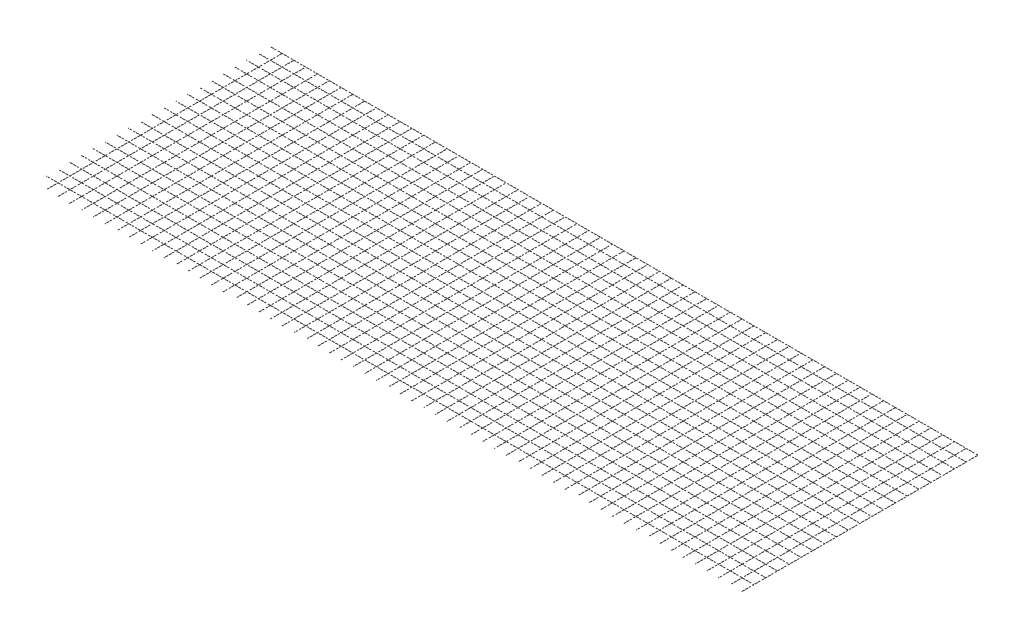
from build123d import *

# Parameters (mm, degrees)
SKETCH2_R              = 0.5
BOSS_EXTRUDE2_DEPTH    = 2000
BOSS_EXTRUDE2_2_DEPTH  = 2000
BOSS_EXTRUDE2_3_DEPTH  = 2000
BOSS_EXTRUDE2_4_DEPTH  = 2000
BOSS_EXTRUDE2_5_DEPTH  = 2000
BOSS_EXTRUDE2_6_DEPTH  = 2000
BOSS_EXTRUDE2_7_DEPTH  = 2000
BOSS_EXTRUDE2_8_DEPTH  = 2000
BOSS_EXTRUDE2_9_DEPTH  = 2000
BOSS_EXTRUDE2_10_DEPTH = 2000
BOSS_EXTRUDE2_11_DEPTH = 2000
BOSS_EXTRUDE2_12_DEPTH = 2000
BOSS_EXTRUDE2_13_DEPTH = 2000
BOSS_EXTRUDE2_14_DEPTH = 2000
BOSS_EXTRUDE2_15_DEPTH = 2000
BOSS_EXTRUDE2_16_DEPTH = 2000
BOSS_EXTRUDE2_17_DEPTH = 2000
BOSS_EXTRUDE2_18_DEPTH = 2000
BOSS_EXTRUDE2_19_DEPTH = 2000
BOSS_EXTRUDE2_20_DEPTH = 2000
BOSS_EXTRUDE2_21_DEPTH = 2000
BOSS_EXTRUDE2_22_DEPTH = 2000
BOSS_EXTRUDE2_23_DEPTH = 2000
BOSS_EXTRUDE2_24_DEPTH = 2000
BOSS_EXTRUDE2_25_DEPTH = 2000
BOSS_EXTRUDE2_26_DEPTH = 2000
BOSS_EXTRUDE2_27_DEPTH = 2000
BOSS_EXTRUDE2_28_DEPTH = 2000
BOSS_EXTRUDE2_29_DEPTH = 2000
BOSS_EXTRUDE2_30_DEPTH = 2000
BOSS_EXTRUDE2_31_DEPTH = 2000
BOSS_EXTRUDE2_32_DEPTH = 2000
BOSS_EXTRUDE2_33_DEPTH = 2000
BOSS_EXTRUDE2_34_DEPTH = 2000
BOSS_EXTRUDE2_35_DEPTH = 2000
BOSS_EXTRUDE2_36_DEPTH = 2000
BOSS_EXTRUDE2_37_DEPTH = 2000
BOSS_EXTRUDE2_38_DEPTH = 2000
BOSS_EXTRUDE2_39_DEPTH = 2000
BOSS_EXTRUDE2_40_DEPTH = 2000
BOSS_EXTRUDE2_41_DEPTH = 2000
BOSS_EXTRUDE2_42_DEPTH = 2000
BOSS_EXTRUDE2_43_DEPTH = 2000
BOSS_EXTRUDE2_44_DEPTH = 2000
BOSS_EXTRUDE2_45_DEPTH = 2000
BOSS_EXTRUDE2_46_DEPTH = 2000
BOSS_EXTRUDE2_47_DEPTH = 2000
BOSS_EXTRUDE2_48_DEPTH = 2000
BOSS_EXTRUDE2_49_DEPTH = 2000
BOSS_EXTRUDE2_50_DEPTH = 2000
BOSS_EXTRUDE2_51_DEPTH = 2000
BOSS_EXTRUDE2_52_DEPTH = 2000
BOSS_EXTRUDE2_53_DEPTH = 2000
BOSS_EXTRUDE2_54_DEPTH = 2000
BOSS_EXTRUDE2_55_DEPTH = 2000
BOSS_EXTRUDE2_56_DEPTH = 2000
BOSS_EXTRUDE2_57_DEPTH = 2000
BOSS_EXTRUDE2_58_DEPTH = 2000
BOSS_EXTRUDE2_59_DEPTH = 2000
BOSS_EXTRUDE2_60_DEPTH = 2000
SKETCH3_R              = 0.5
BOSS_EXTRUDE3_DEPTH    = 6000
BOSS_EXTRUDE3_2_DEPTH  = 6000
BOSS_EXTRUDE3_3_DEPTH  = 6000
BOSS_EXTRUDE3_4_DEPTH  = 6000
BOSS_EXTRUDE3_5_DEPTH  = 6000
BOSS_EXTRUDE3_6_DEPTH  = 6000
BOSS_EXTRUDE3_7_DEPTH  = 6000
BOSS_EXTRUDE3_8_DEPTH  = 6000
BOSS_EXTRUDE3_9_DEPTH  = 6000
BOSS_EXTRUDE3_10_DEPTH = 6000
BOSS_EXTRUDE3_11_DEPTH = 6000
BOSS_EXTRUDE3_12_DEPTH = 6000
BOSS_EXTRUDE3_13_DEPTH = 6000
BOSS_EXTRUDE3_14_DEPTH = 6000
BOSS_EXTRUDE3_15_DEPTH = 6000
BOSS_EXTRUDE3_16_DEPTH = 6000
BOSS_EXTRUDE3_17_DEPTH = 6000
BOSS_EXTRUDE3_18_DEPTH = 6000
BOSS_EXTRUDE3_19_DEPTH = 6000
BOSS_EXTRUDE3_20_DEPTH = 6000


with BuildPart() as part:
    # Sketch2 → Boss-Extrude2 (new body)
    with BuildSketch(Plane.XY):
        with Locations((2815.818546951, 0)):
            Circle(SKETCH2_R)
    extrude(amount=BOSS_EXTRUDE2_DEPTH)


with BuildPart() as body_2:
    # Sketch2 → Boss-Extrude2 2 (new body)
    with BuildSketch(Plane.XY):
        with Locations((2915.818546951, 0)):
            Circle(SKETCH2_R)
    extrude(amount=BOSS_EXTRUDE2_2_DEPTH)


with BuildPart() as body_3:
    # Sketch2 → Boss-Extrude2 3 (new body)
    with BuildSketch(Plane.XY):
        with Locations((3015.818546951, 0)):
            Circle(SKETCH2_R)
    extrude(amount=BOSS_EXTRUDE2_3_DEPTH)


with BuildPart() as body_4:
    # Sketch2 → Boss-Extrude2 4 (new body)
    with BuildSketch(Plane.XY):
        with Locations((3115.818546951, 0)):
            Circle(SKETCH2_R)
    extrude(amount=BOSS_EXTRUDE2_4_DEPTH)


with BuildPart() as body_5:
    # Sketch2 → Boss-Extrude2 5 (new body)
    with BuildSketch(Plane.XY):
        with Locations((3215.818546951, 0)):
            Circle(SKETCH2_R)
    extrude(amount=BOSS_EXTRUDE2_5_DEPTH)


with BuildPart() as body_6:
    # Sketch2 → Boss-Extrude2 6 (new body)
    with BuildSketch(Plane.XY):
        with Locations((3315.818546951, 0)):
            Circle(SKETCH2_R)
    extrude(amount=BOSS_EXTRUDE2_6_DEPTH)


with BuildPart() as body_7:
    # Sketch2 → Boss-Extrude2 7 (new body)
    with BuildSketch(Plane.XY):
        with Locations((3415.818546951, 0)):
            Circle(SKETCH2_R)
    extrude(amount=BOSS_EXTRUDE2_7_DEPTH)


with BuildPart() as body_8:
    # Sketch2 → Boss-Extrude2 8 (new body)
    with BuildSketch(Plane.XY):
        with Locations((3515.818546951, 0)):
            Circle(SKETCH2_R)
    extrude(amount=BOSS_EXTRUDE2_8_DEPTH)


with BuildPart() as body_9:
    # Sketch2 → Boss-Extrude2 9 (new body)
    with BuildSketch(Plane.XY):
        with Locations((3615.818546951, 0)):
            Circle(SKETCH2_R)
    extrude(amount=BOSS_EXTRUDE2_9_DEPTH)


with BuildPart() as body_10:
    # Sketch2 → Boss-Extrude2 10 (new body)
    with BuildSketch(Plane.XY):
        with Locations((3715.818546951, 0)):
            Circle(SKETCH2_R)
    extrude(amount=BOSS_EXTRUDE2_10_DEPTH)


with BuildPart() as body_11:
    # Sketch2 → Boss-Extrude2 11 (new body)
    with BuildSketch(Plane.XY):
        with Locations((3815.818546951, 0)):
            Circle(SKETCH2_R)
    extrude(amount=BOSS_EXTRUDE2_11_DEPTH)


with BuildPart() as body_12:
    # Sketch2 → Boss-Extrude2 12 (new body)
    with BuildSketch(Plane.XY):
        with Locations((3915.818546951, 0)):
            Circle(SKETCH2_R)
    extrude(amount=BOSS_EXTRUDE2_12_DEPTH)


with BuildPart() as body_13:
    # Sketch2 → Boss-Extrude2 13 (new body)
    with BuildSketch(Plane.XY):
        with Locations((4015.818546951, 0)):
            Circle(SKETCH2_R)
    extrude(amount=BOSS_EXTRUDE2_13_DEPTH)


with BuildPart() as body_14:
    # Sketch2 → Boss-Extrude2 14 (new body)
    with BuildSketch(Plane.XY):
        with Locations((4115.818546951, 0)):
            Circle(SKETCH2_R)
    extrude(amount=BOSS_EXTRUDE2_14_DEPTH)


with BuildPart() as body_15:
    # Sketch2 → Boss-Extrude2 15 (new body)
    with BuildSketch(Plane.XY):
        with Locations((4215.818546951, 0)):
            Circle(SKETCH2_R)
    extrude(amount=BOSS_EXTRUDE2_15_DEPTH)


with BuildPart() as body_16:
    # Sketch2 → Boss-Extrude2 16 (new body)
    with BuildSketch(Plane.XY):
        with Locations((4315.818546951, 0)):
            Circle(SKETCH2_R)
    extrude(amount=BOSS_EXTRUDE2_16_DEPTH)


with BuildPart() as body_17:
    # Sketch2 → Boss-Extrude2 17 (new body)
    with BuildSketch(Plane.XY):
        with Locations((4415.818546951, 0)):
            Circle(SKETCH2_R)
    extrude(amount=BOSS_EXTRUDE2_17_DEPTH)


with BuildPart() as body_18:
    # Sketch2 → Boss-Extrude2 18 (new body)
    with BuildSketch(Plane.XY):
        with Locations((4515.818546951, 0)):
            Circle(SKETCH2_R)
    extrude(amount=BOSS_EXTRUDE2_18_DEPTH)


with BuildPart() as body_19:
    # Sketch2 → Boss-Extrude2 19 (new body)
    with BuildSketch(Plane.XY):
        with Locations((4615.818546951, 0)):
            Circle(SKETCH2_R)
    extrude(amount=BOSS_EXTRUDE2_19_DEPTH)


with BuildPart() as body_20:
    # Sketch2 → Boss-Extrude2 20 (new body)
    with BuildSketch(Plane.XY):
        with Locations((4715.818546951, 0)):
            Circle(SKETCH2_R)
    extrude(amount=BOSS_EXTRUDE2_20_DEPTH)


with BuildPart() as body_21:
    # Sketch2 → Boss-Extrude2 21 (new body)
    with BuildSketch(Plane.XY):
        with Locations((4815.818546951, 0)):
            Circle(SKETCH2_R)
    extrude(amount=BOSS_EXTRUDE2_21_DEPTH)


with BuildPart() as body_22:
    # Sketch2 → Boss-Extrude2 22 (new body)
    with BuildSketch(Plane.XY):
        with Locations((4915.818546951, 0)):
            Circle(SKETCH2_R)
    extrude(amount=BOSS_EXTRUDE2_22_DEPTH)


with BuildPart() as body_23:
    # Sketch2 → Boss-Extrude2 23 (new body)
    with BuildSketch(Plane.XY):
        with Locations((5015.818546951, 0)):
            Circle(SKETCH2_R)
    extrude(amount=BOSS_EXTRUDE2_23_DEPTH)


with BuildPart() as body_24:
    # Sketch2 → Boss-Extrude2 24 (new body)
    with BuildSketch(Plane.XY):
        with Locations((5115.818546951, 0)):
            Circle(SKETCH2_R)
    extrude(amount=BOSS_EXTRUDE2_24_DEPTH)


with BuildPart() as body_25:
    # Sketch2 → Boss-Extrude2 25 (new body)
    with BuildSketch(Plane.XY):
        with Locations((5215.818546951, 0)):
            Circle(SKETCH2_R)
    extrude(amount=BOSS_EXTRUDE2_25_DEPTH)


with BuildPart() as body_26:
    # Sketch2 → Boss-Extrude2 26 (new body)
    with BuildSketch(Plane.XY):
        with Locations((5315.818546951, 0)):
            Circle(SKETCH2_R)
    extrude(amount=BOSS_EXTRUDE2_26_DEPTH)


with BuildPart() as body_27:
    # Sketch2 → Boss-Extrude2 27 (new body)
    with BuildSketch(Plane.XY):
        with Locations((5415.818546951, 0)):
            Circle(SKETCH2_R)
    extrude(amount=BOSS_EXTRUDE2_27_DEPTH)


with BuildPart() as body_28:
    # Sketch2 → Boss-Extrude2 28 (new body)
    with BuildSketch(Plane.XY):
        with Locations((5515.818546951, 0)):
            Circle(SKETCH2_R)
    extrude(amount=BOSS_EXTRUDE2_28_DEPTH)


with BuildPart() as body_29:
    # Sketch2 → Boss-Extrude2 29 (new body)
    with BuildSketch(Plane.XY):
        with Locations((5615.818546951, 0)):
            Circle(SKETCH2_R)
    extrude(amount=BOSS_EXTRUDE2_29_DEPTH)


with BuildPart() as body_30:
    # Sketch2 → Boss-Extrude2 30 (new body)
    with BuildSketch(Plane.XY):
        with Locations((5715.818546951, 0)):
            Circle(SKETCH2_R)
    extrude(amount=BOSS_EXTRUDE2_30_DEPTH)


with BuildPart() as body_31:
    # Sketch2 → Boss-Extrude2 31 (new body)
    with BuildSketch(Plane.XY):
        with Locations((5815.818546951, 0)):
            Circle(SKETCH2_R)
    extrude(amount=BOSS_EXTRUDE2_31_DEPTH)


with BuildPart() as body_32:
    # Sketch2 → Boss-Extrude2 32 (new body)
    with BuildSketch(Plane.XY):
        with Locations((5915.818546951, 0)):
            Circle(SKETCH2_R)
    extrude(amount=BOSS_EXTRUDE2_32_DEPTH)


with BuildPart() as body_33:
    # Sketch2 → Boss-Extrude2 33 (new body)
    with BuildSketch(Plane.XY):
        with Locations((6015.818546951, 0)):
            Circle(SKETCH2_R)
    extrude(amount=BOSS_EXTRUDE2_33_DEPTH)


with BuildPart() as body_34:
    # Sketch2 → Boss-Extrude2 34 (new body)
    with BuildSketch(Plane.XY):
        with Locations((6115.818546951, 0)):
            Circle(SKETCH2_R)
    extrude(amount=BOSS_EXTRUDE2_34_DEPTH)


with BuildPart() as body_35:
    # Sketch2 → Boss-Extrude2 35 (new body)
    with BuildSketch(Plane.XY):
        with Locations((6215.818546951, 0)):
            Circle(SKETCH2_R)
    extrude(amount=BOSS_EXTRUDE2_35_DEPTH)


with BuildPart() as body_36:
    # Sketch2 → Boss-Extrude2 36 (new body)
    with BuildSketch(Plane.XY):
        with Locations((6315.818546951, 0)):
            Circle(SKETCH2_R)
    extrude(amount=BOSS_EXTRUDE2_36_DEPTH)


with BuildPart() as body_37:
    # Sketch2 → Boss-Extrude2 37 (new body)
    with BuildSketch(Plane.XY):
        with Locations((6415.818546951, 0)):
            Circle(SKETCH2_R)
    extrude(amount=BOSS_EXTRUDE2_37_DEPTH)


with BuildPart() as body_38:
    # Sketch2 → Boss-Extrude2 38 (new body)
    with BuildSketch(Plane.XY):
        with Locations((6515.818546951, 0)):
            Circle(SKETCH2_R)
    extrude(amount=BOSS_EXTRUDE2_38_DEPTH)


with BuildPart() as body_39:
    # Sketch2 → Boss-Extrude2 39 (new body)
    with BuildSketch(Plane.XY):
        with Locations((6615.818546951, 0)):
            Circle(SKETCH2_R)
    extrude(amount=BOSS_EXTRUDE2_39_DEPTH)


with BuildPart() as body_40:
    # Sketch2 → Boss-Extrude2 40 (new body)
    with BuildSketch(Plane.XY):
        with Locations((6715.818546951, 0)):
            Circle(SKETCH2_R)
    extrude(amount=BOSS_EXTRUDE2_40_DEPTH)


with BuildPart() as body_41:
    # Sketch2 → Boss-Extrude2 41 (new body)
    with BuildSketch(Plane.XY):
        with Locations((6815.818546951, 0)):
            Circle(SKETCH2_R)
    extrude(amount=BOSS_EXTRUDE2_41_DEPTH)


with BuildPart() as body_42:
    # Sketch2 → Boss-Extrude2 42 (new body)
    with BuildSketch(Plane.XY):
        with Locations((6915.818546951, 0)):
            Circle(SKETCH2_R)
    extrude(amount=BOSS_EXTRUDE2_42_DEPTH)


with BuildPart() as body_43:
    # Sketch2 → Boss-Extrude2 43 (new body)
    with BuildSketch(Plane.XY):
        with Locations((7015.818546951, 0)):
            Circle(SKETCH2_R)
    extrude(amount=BOSS_EXTRUDE2_43_DEPTH)


with BuildPart() as body_44:
    # Sketch2 → Boss-Extrude2 44 (new body)
    with BuildSketch(Plane.XY):
        with Locations((7115.818546951, 0)):
            Circle(SKETCH2_R)
    extrude(amount=BOSS_EXTRUDE2_44_DEPTH)


with BuildPart() as body_45:
    # Sketch2 → Boss-Extrude2 45 (new body)
    with BuildSketch(Plane.XY):
        with Locations((7215.818546951, 0)):
            Circle(SKETCH2_R)
    extrude(amount=BOSS_EXTRUDE2_45_DEPTH)


with BuildPart() as body_46:
    # Sketch2 → Boss-Extrude2 46 (new body)
    with BuildSketch(Plane.XY):
        with Locations((7315.818546951, 0)):
            Circle(SKETCH2_R)
    extrude(amount=BOSS_EXTRUDE2_46_DEPTH)


with BuildPart() as body_47:
    # Sketch2 → Boss-Extrude2 47 (new body)
    with BuildSketch(Plane.XY):
        with Locations((7415.818546951, 0)):
            Circle(SKETCH2_R)
    extrude(amount=BOSS_EXTRUDE2_47_DEPTH)


with BuildPart() as body_48:
    # Sketch2 → Boss-Extrude2 48 (new body)
    with BuildSketch(Plane.XY):
        with Locations((7515.818546951, 0)):
            Circle(SKETCH2_R)
    extrude(amount=BOSS_EXTRUDE2_48_DEPTH)


with BuildPart() as body_49:
    # Sketch2 → Boss-Extrude2 49 (new body)
    with BuildSketch(Plane.XY):
        with Locations((7615.818546951, 0)):
            Circle(SKETCH2_R)
    extrude(amount=BOSS_EXTRUDE2_49_DEPTH)


with BuildPart() as body_50:
    # Sketch2 → Boss-Extrude2 50 (new body)
    with BuildSketch(Plane.XY):
        with Locations((7715.818546951, 0)):
            Circle(SKETCH2_R)
    extrude(amount=BOSS_EXTRUDE2_50_DEPTH)


with BuildPart() as body_51:
    # Sketch2 → Boss-Extrude2 51 (new body)
    with BuildSketch(Plane.XY):
        with Locations((7815.818546951, 0)):
            Circle(SKETCH2_R)
    extrude(amount=BOSS_EXTRUDE2_51_DEPTH)


with BuildPart() as body_52:
    # Sketch2 → Boss-Extrude2 52 (new body)
    with BuildSketch(Plane.XY):
        with Locations((7915.818546951, 0)):
            Circle(SKETCH2_R)
    extrude(amount=BOSS_EXTRUDE2_52_DEPTH)


with BuildPart() as body_53:
    # Sketch2 → Boss-Extrude2 53 (new body)
    with BuildSketch(Plane.XY):
        with Locations((8015.818546951, 0)):
            Circle(SKETCH2_R)
    extrude(amount=BOSS_EXTRUDE2_53_DEPTH)


with BuildPart() as body_54:
    # Sketch2 → Boss-Extrude2 54 (new body)
    with BuildSketch(Plane.XY):
        with Locations((8115.818546951, 0)):
            Circle(SKETCH2_R)
    extrude(amount=BOSS_EXTRUDE2_54_DEPTH)


with BuildPart() as body_55:
    # Sketch2 → Boss-Extrude2 55 (new body)
    with BuildSketch(Plane.XY):
        with Locations((8215.818546951, 0)):
            Circle(SKETCH2_R)
    extrude(amount=BOSS_EXTRUDE2_55_DEPTH)


with BuildPart() as body_56:
    # Sketch2 → Boss-Extrude2 56 (new body)
    with BuildSketch(Plane.XY):
        with Locations((8315.818546951, 0)):
            Circle(SKETCH2_R)
    extrude(amount=BOSS_EXTRUDE2_56_DEPTH)


with BuildPart() as body_57:
    # Sketch2 → Boss-Extrude2 57 (new body)
    with BuildSketch(Plane.XY):
        with Locations((8415.818546951, 0)):
            Circle(SKETCH2_R)
    extrude(amount=BOSS_EXTRUDE2_57_DEPTH)


with BuildPart() as body_58:
    # Sketch2 → Boss-Extrude2 58 (new body)
    with BuildSketch(Plane.XY):
        with Locations((8515.818546951, 0)):
            Circle(SKETCH2_R)
    extrude(amount=BOSS_EXTRUDE2_58_DEPTH)


with BuildPart() as body_59:
    # Sketch2 → Boss-Extrude2 59 (new body)
    with BuildSketch(Plane.XY):
        with Locations((8615.818546951, 0)):
            Circle(SKETCH2_R)
    extrude(amount=BOSS_EXTRUDE2_59_DEPTH)


with BuildPart() as body_60:
    # Sketch2 → Boss-Extrude2 60 (new body)
    with BuildSketch(Plane.XY):
        with Locations((8715.818546951, 0)):
            Circle(SKETCH2_R)
    extrude(amount=BOSS_EXTRUDE2_60_DEPTH)


with BuildPart() as body_61:
    # Sketch3 → Boss-Extrude3 (new body)
    with BuildSketch(Plane.ZY.offset(-8715.318546951)):
        with Locations((0.5, 1)):
            Circle(SKETCH3_R)
    extrude(amount=BOSS_EXTRUDE3_DEPTH)


with BuildPart() as body_62:
    # Sketch3 → Boss-Extrude3 2 (new body)
    with BuildSketch(Plane.ZY.offset(-8715.318546951)):
        with Locations((100.5, 1)):
            Circle(SKETCH3_R)
    extrude(amount=BOSS_EXTRUDE3_2_DEPTH)


with BuildPart() as body_63:
    # Sketch3 → Boss-Extrude3 3 (new body)
    with BuildSketch(Plane.ZY.offset(-8715.318546951)):
        with Locations((200.5, 1)):
            Circle(SKETCH3_R)
    extrude(amount=BOSS_EXTRUDE3_3_DEPTH)


with BuildPart() as body_64:
    # Sketch3 → Boss-Extrude3 4 (new body)
    with BuildSketch(Plane.ZY.offset(-8715.318546951)):
        with Locations((300.5, 1)):
            Circle(SKETCH3_R)
    extrude(amount=BOSS_EXTRUDE3_4_DEPTH)


with BuildPart() as body_65:
    # Sketch3 → Boss-Extrude3 5 (new body)
    with BuildSketch(Plane.ZY.offset(-8715.318546951)):
        with Locations((400.5, 1)):
            Circle(SKETCH3_R)
    extrude(amount=BOSS_EXTRUDE3_5_DEPTH)


with BuildPart() as body_66:
    # Sketch3 → Boss-Extrude3 6 (new body)
    with BuildSketch(Plane.ZY.offset(-8715.318546951)):
        with Locations((500.5, 1)):
            Circle(SKETCH3_R)
    extrude(amount=BOSS_EXTRUDE3_6_DEPTH)


with BuildPart() as body_67:
    # Sketch3 → Boss-Extrude3 7 (new body)
    with BuildSketch(Plane.ZY.offset(-8715.318546951)):
        with Locations((600.5, 1)):
            Circle(SKETCH3_R)
    extrude(amount=BOSS_EXTRUDE3_7_DEPTH)


with BuildPart() as body_68:
    # Sketch3 → Boss-Extrude3 8 (new body)
    with BuildSketch(Plane.ZY.offset(-8715.318546951)):
        with Locations((700.5, 1)):
            Circle(SKETCH3_R)
    extrude(amount=BOSS_EXTRUDE3_8_DEPTH)


with BuildPart() as body_69:
    # Sketch3 → Boss-Extrude3 9 (new body)
    with BuildSketch(Plane.ZY.offset(-8715.318546951)):
        with Locations((800.5, 1)):
            Circle(SKETCH3_R)
    extrude(amount=BOSS_EXTRUDE3_9_DEPTH)


with BuildPart() as body_70:
    # Sketch3 → Boss-Extrude3 10 (new body)
    with BuildSketch(Plane.ZY.offset(-8715.318546951)):
        with Locations((900.5, 1)):
            Circle(SKETCH3_R)
    extrude(amount=BOSS_EXTRUDE3_10_DEPTH)


with BuildPart() as body_71:
    # Sketch3 → Boss-Extrude3 11 (new body)
    with BuildSketch(Plane.ZY.offset(-8715.318546951)):
        with Locations((1000.5, 1)):
            Circle(SKETCH3_R)
    extrude(amount=BOSS_EXTRUDE3_11_DEPTH)


with BuildPart() as body_72:
    # Sketch3 → Boss-Extrude3 12 (new body)
    with BuildSketch(Plane.ZY.offset(-8715.318546951)):
        with Locations((1100.5, 1)):
            Circle(SKETCH3_R)
    extrude(amount=BOSS_EXTRUDE3_12_DEPTH)


with BuildPart() as body_73:
    # Sketch3 → Boss-Extrude3 13 (new body)
    with BuildSketch(Plane.ZY.offset(-8715.318546951)):
        with Locations((1200.5, 1)):
            Circle(SKETCH3_R)
    extrude(amount=BOSS_EXTRUDE3_13_DEPTH)


with BuildPart() as body_74:
    # Sketch3 → Boss-Extrude3 14 (new body)
    with BuildSketch(Plane.ZY.offset(-8715.318546951)):
        with Locations((1300.5, 1)):
            Circle(SKETCH3_R)
    extrude(amount=BOSS_EXTRUDE3_14_DEPTH)


with BuildPart() as body_75:
    # Sketch3 → Boss-Extrude3 15 (new body)
    with BuildSketch(Plane.ZY.offset(-8715.318546951)):
        with Locations((1400.5, 1)):
            Circle(SKETCH3_R)
    extrude(amount=BOSS_EXTRUDE3_15_DEPTH)


with BuildPart() as body_76:
    # Sketch3 → Boss-Extrude3 16 (new body)
    with BuildSketch(Plane.ZY.offset(-8715.318546951)):
        with Locations((1500.5, 1)):
            Circle(SKETCH3_R)
    extrude(amount=BOSS_EXTRUDE3_16_DEPTH)


with BuildPart() as body_77:
    # Sketch3 → Boss-Extrude3 17 (new body)
    with BuildSketch(Plane.ZY.offset(-8715.318546951)):
        with Locations((1600.5, 1)):
            Circle(SKETCH3_R)
    extrude(amount=BOSS_EXTRUDE3_17_DEPTH)


with BuildPart() as body_78:
    # Sketch3 → Boss-Extrude3 18 (new body)
    with BuildSketch(Plane.ZY.offset(-8715.318546951)):
        with Locations((1700.5, 1)):
            Circle(SKETCH3_R)
    extrude(amount=BOSS_EXTRUDE3_18_DEPTH)


with BuildPart() as body_79:
    # Sketch3 → Boss-Extrude3 19 (new body)
    with BuildSketch(Plane.ZY.offset(-8715.318546951)):
        with Locations((1800.5, 1)):
            Circle(SKETCH3_R)
    extrude(amount=BOSS_EXTRUDE3_19_DEPTH)


with BuildPart() as body_80:
    # Sketch3 → Boss-Extrude3 20 (new body)
    with BuildSketch(Plane.ZY.offset(-8715.318546951)):
        with Locations((1900.5, 1)):
            Circle(SKETCH3_R)
    extrude(amount=BOSS_EXTRUDE3_20_DEPTH)


solid = Compound([part.part, body_2.part, body_3.part, body_4.part, body_5.part, body_6.part, body_7.part, body_8.part, body_9.part, body_10.part, body_11.part, body_12.part, body_13.part, body_14.part, body_15.part, body_16.part, body_17.part, body_18.part, body_19.part, body_20.part, body_21.part, body_22.part, body_23.part, body_24.part, body_25.part, body_26.part, body_27.part, body_28.part, body_29.part, body_30.part, body_31.part, body_32.part, body_33.part, body_34.part, body_35.part, body_36.part, body_37.part, body_38.part, body_39.part, body_40.part, body_41.part, body_42.part, body_43.part, body_44.part, body_45.part, body_46.part, body_47.part, body_48.part, body_49.part, body_50.part, body_51.part, body_52.part, body_53.part, body_54.part, body_55.part, body_56.part, body_57.part, body_58.part, body_59.part, body_60.part, body_61.part, body_62.part, body_63.part, body_64.part, body_65.part, body_66.part, body_67.part, body_68.part, body_69.part, body_70.part, body_71.part, body_72.part, body_73.part, body_74.part, body_75.part, body_76.part, body_77.part, body_78.part, body_79.part, body_80.part])
